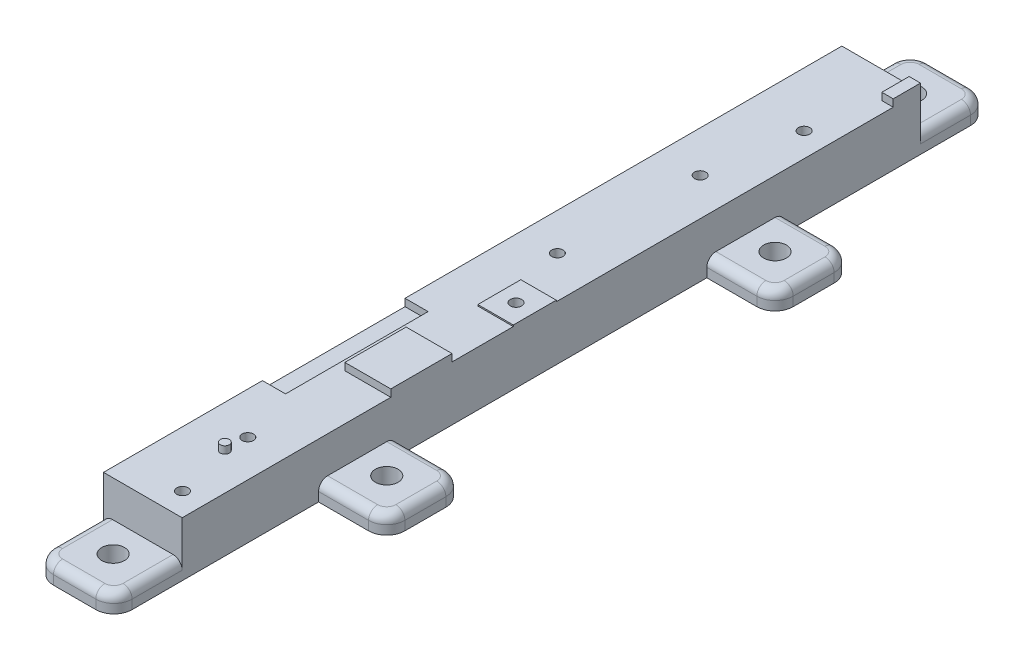
from build123d import *

# Parameters (mm, degrees)
SKETCH1_R           = 1
SKETCH1_R_2         = 1.25
SKETCH1_W           = 10.1
SKETCH1_H           = 13.47
SKETCH1_W_2         = 2.5
SKETCH1_H_2         = 6
SKETCH1_W_3         = 5.08
SKETCH1_H_3         = 31.36
BOSS_EXTRUDE1_DEPTH = 12
SKETCH1_3_W         = 10.1
SKETCH1_3_H         = 13.47
SKETCH1_3_W_2       = 2.5
SKETCH1_3_H_2       = 6
SKETCH1_3_R         = 1
BOSS_EXTRUDE2_DEPTH = 1.6
SKETCH1_4_W         = 5.08
SKETCH1_4_H         = 31.36
CUT_EXTRUDE1_DEPTH  = 1.6
BOSS_EXTRUDE3_START = 0.3
SKETCH2_W           = 7.8
SKETCH2_H           = 9.45
SKETCH2_R           = 1.25
BOSS_EXTRUDE3_DEPTH = 0.3
SKETCH3_W           = 17.3
SKETCH3_H           = 4
BOSS_EXTRUDE4_DEPTH = 15
SKETCH4_W           = 17.3
SKETCH4_H           = 4
BOSS_EXTRUDE5_DEPTH = 15
SKETCH5_W           = 17
SKETCH5_H           = 4
BOSS_EXTRUDE6_DEPTH = 15
FILLET1_R           = 4
FILLET2_R           = 2
CUT_EXTRUDE2_REACH  = 180.5
SKETCH6_R           = 2.5


with BuildPart() as part:
    # Sketch1 → Boss-Extrude1 (new body)
    # profile 1 of 5: a face of its own
    with BuildSketch(Plane(origin=(0, 0, 0), x_dir=(1, 0, 0), z_dir=(0, 1, 0))):
        Polygon((-2.5, -6), (-2.5, 0), (-17.3, 0), (-17.3, -96.08), (-12.22, -96.08), (-12.22, -127.44), (-17.3, -127.44), (-17.3, -162.4), (0, -162.4), (0, -116.51), (-10.1, -116.51), (-10.1, -103.04), (0, -103.04), (0, -6), align=None)
        with Locations((-8.115, -144.895)):
            Circle(SKETCH1_R, mode=Mode.SUBTRACT)
        with Locations(Location((-5.05, -157.28, 0), (0, 0, 270))):
            Circle(SKETCH1_R_2, mode=Mode.SUBTRACT)
        with Locations(Location((-8.115, -139.85, 0), (0, 0, 270))):
            Circle(SKETCH1_R_2, mode=Mode.SUBTRACT)
        with Locations(Location((-3.95, -85.02, 0), (0, 0, 270))):
            Circle(SKETCH1_R_2, mode=Mode.SUBTRACT)
        with Locations(Location((-9.115, -70.745, 0), (0, 0, 270))):
            Circle(SKETCH1_R_2, mode=Mode.SUBTRACT)
        with Locations(Location((-8.25, -40.21, 0), (0, 0, 270))):
            Circle(SKETCH1_R_2, mode=Mode.SUBTRACT)
        with Locations(Location((-5.3, -20.3, 0), (0, 0, 270))):
            Circle(SKETCH1_R_2, mode=Mode.SUBTRACT)
    # profile 2 of 5: a face of its own
    with BuildSketch(Plane(origin=(0, 0, 0), x_dir=(1, 0, 0), z_dir=(0, 1, 0))):
        with Locations((-5.05, -109.775)):
            Rectangle(SKETCH1_W, SKETCH1_H)
    # profile 3 of 5: a face of its own
    with BuildSketch(Plane(origin=(0, 0, 0), x_dir=(1, 0, 0), z_dir=(0, 1, 0))):
        with Locations((-1.25, -3)):
            Rectangle(SKETCH1_W_2, SKETCH1_H_2)
    # profile 4 of 5: a face of its own
    with BuildSketch(Plane(origin=(0, 0, 0), x_dir=(1, 0, 0), z_dir=(0, 1, 0))):
        with Locations((-14.76, -111.76)):
            Rectangle(SKETCH1_W_3, SKETCH1_H_3)
    # profile 5 of 5: a face of its own
    with BuildSketch(Plane(origin=(0, 0, 0), x_dir=(1, 0, 0), z_dir=(0, 1, 0))):
        with Locations((-8.115, -144.895)):
            Circle(SKETCH1_R)
    extrude(amount=-BOSS_EXTRUDE1_DEPTH)

    # Sketch1<3> → Boss-Extrude2 (add)
    with BuildSketch(Plane(origin=(0, 0, 0), x_dir=(1, 0, 0), z_dir=(0, 1, 0))):
        with Locations((-5.05, -109.775)):
            Rectangle(SKETCH1_3_W, SKETCH1_3_H)
        with Locations((-1.25, -3)):
            Rectangle(SKETCH1_3_W_2, SKETCH1_3_H_2)
        with Locations(Location((-8.115, -144.895, 0), (0, 0, 270))):
            Circle(SKETCH1_3_R)
    extrude(amount=BOSS_EXTRUDE2_DEPTH)

    # Sketch1<4> → Cut-Extrude1 (cut)
    with BuildSketch(Plane(origin=(0, 0, 0), x_dir=(1, 0, 0), z_dir=(0, 1, 0))):
        with Locations((-14.76, -111.76)):
            Rectangle(SKETCH1_4_W, SKETCH1_4_H)
    extrude(amount=-CUT_EXTRUDE1_DEPTH, mode=Mode.SUBTRACT)

    # Sketch2 → Boss-Extrude3 (add)
    with BuildSketch(Plane(origin=(0, 0, 0), x_dir=(1, 0, 0), z_dir=(0, 1, 0)).offset(BOSS_EXTRUDE3_START)):
        with Locations((-3.9, -84.835)):
            Rectangle(SKETCH2_W, SKETCH2_H)
        with Locations(Location((-3.95, -85.02, 0), (0, 0, 270))):
            Circle(SKETCH2_R, mode=Mode.SUBTRACT)
    extrude(amount=-BOSS_EXTRUDE3_DEPTH)

    # Sketch3 → Boss-Extrude4 (add)
    with BuildSketch(Plane.XY.offset(162.4)):
        with Locations((-8.65, -10)):
            Rectangle(SKETCH3_W, SKETCH3_H)
    extrude(amount=BOSS_EXTRUDE4_DEPTH)

    # Sketch4 → Boss-Extrude5 (add)
    with BuildSketch(Plane(origin=(0, 0, 0), x_dir=(-1, 0, 0), z_dir=(0, 0, -1))):
        with Locations((8.65, -10)):
            Rectangle(SKETCH4_W, SKETCH4_H)
    extrude(amount=BOSS_EXTRUDE5_DEPTH)

    # Sketch5 → Boss-Extrude6 (add)
    with BuildSketch(Plane(origin=(0, 0, 0), x_dir=(0, 0, -1), z_dir=(1, 0, 0))):
        with Locations((-123.9, -10)):
            Rectangle(SKETCH5_W, SKETCH5_H)
        with Locations((-38.5, -10)):
            Rectangle(SKETCH5_W, SKETCH5_H)
    extrude(amount=BOSS_EXTRUDE6_DEPTH)

    # Fillet1
    fillet1_edges = [part.edges().sort_by_distance(p)[0] for p in [
        (-17.3, -10, -15),
        (0, -10, -15),
        (15, -10, 132.4),
        (15, -10, 115.4),
        (15, -10, 47),
        (15, -10, 30),
        (0, -10, 177.4),
        (-17.3, -10, 177.4),
    ]]
    fillet(fillet1_edges, radius=FILLET1_R)

    # Fillet2
    fillet2_edges = [part.edges().sort_by_distance(p)[0] for p in [
        (-8.65, -8, -15),
        (-17.3, -8, -5.5),
        (-1.171572875, -8, -13.828427125),
        (-16.128427125, -8, -13.828427125),
        (-17.3, -8, 167.9),
        (15, -8, 38.5),
        (5.5, -8, 47),
        (5.5, -8, 30),
        (13.828427125, -8, 45.828427125),
        (13.828427125, -8, 31.171572875),
        (15, -8, 123.9),
        (5.5, -8, 132.4),
        (5.5, -8, 115.4),
        (13.828427125, -8, 131.228427125),
        (13.828427125, -8, 116.571572875),
        (-8.65, -8, 177.4),
        (-1.171572875, -8, 176.228427125),
        (-16.128427125, -8, 176.228427125),
    ]]
    fillet(fillet2_edges, radius=FILLET2_R)

    # Sketch6 → Cut-Extrude2 (cut, up to next)
    with BuildSketch(Plane(origin=(0, -8, 0), x_dir=(1, 0, 0), z_dir=(0, 1, 0)), mode=Mode.PRIVATE) as cut_extrude2_sk1:
        with Locations(Location((-8.68, 6.5, 0), (0, 0, 180))):
            Circle(SKETCH6_R)
    cut_extrude2_tool1 = extrude(cut_extrude2_sk1.sketch, amount=-CUT_EXTRUDE2_REACH, mode=Mode.PRIVATE) & part.part
    # Sketch6 → Cut-Extrude2 (cut, up to next)
    with BuildSketch(Plane(origin=(0, -8, 0), x_dir=(1, 0, 0), z_dir=(0, 1, 0)), mode=Mode.PRIVATE) as cut_extrude2_sk2:
        with Locations(Location((6.5, -38.5, 0), (0, 0, 180))):
            Circle(SKETCH6_R)
    cut_extrude2_tool2 = extrude(cut_extrude2_sk2.sketch, amount=-CUT_EXTRUDE2_REACH, mode=Mode.PRIVATE) & part.part
    # Sketch6 → Cut-Extrude2 (cut, up to next)
    with BuildSketch(Plane(origin=(0, -8, 0), x_dir=(1, 0, 0), z_dir=(0, 1, 0)), mode=Mode.PRIVATE) as cut_extrude2_sk3:
        with Locations(Location((6.5, -123.9, 0), (0, 0, 180))):
            Circle(SKETCH6_R)
    cut_extrude2_tool3 = extrude(cut_extrude2_sk3.sketch, amount=-CUT_EXTRUDE2_REACH, mode=Mode.PRIVATE) & part.part
    # Sketch6 → Cut-Extrude2 (cut, up to next)
    with BuildSketch(Plane(origin=(0, -8, 0), x_dir=(1, 0, 0), z_dir=(0, 1, 0)), mode=Mode.PRIVATE) as cut_extrude2_sk4:
        with Locations(Location((-8.68, -168.9, 0), (0, 0, 180))):
            Circle(SKETCH6_R)
    cut_extrude2_tool4 = extrude(cut_extrude2_sk4.sketch, amount=-CUT_EXTRUDE2_REACH, mode=Mode.PRIVATE) & part.part
    add(cut_extrude2_tool1.solids().sort_by_distance((-8.68, -8, -6.5))[0], mode=Mode.SUBTRACT)
    add(cut_extrude2_tool2.solids().sort_by_distance((6.5, -8, 38.5))[0], mode=Mode.SUBTRACT)
    add(cut_extrude2_tool3.solids().sort_by_distance((6.5, -8, 123.9))[0], mode=Mode.SUBTRACT)
    add(cut_extrude2_tool4.solids().sort_by_distance((-8.68, -8, 168.9))[0], mode=Mode.SUBTRACT)


solid = part.part
